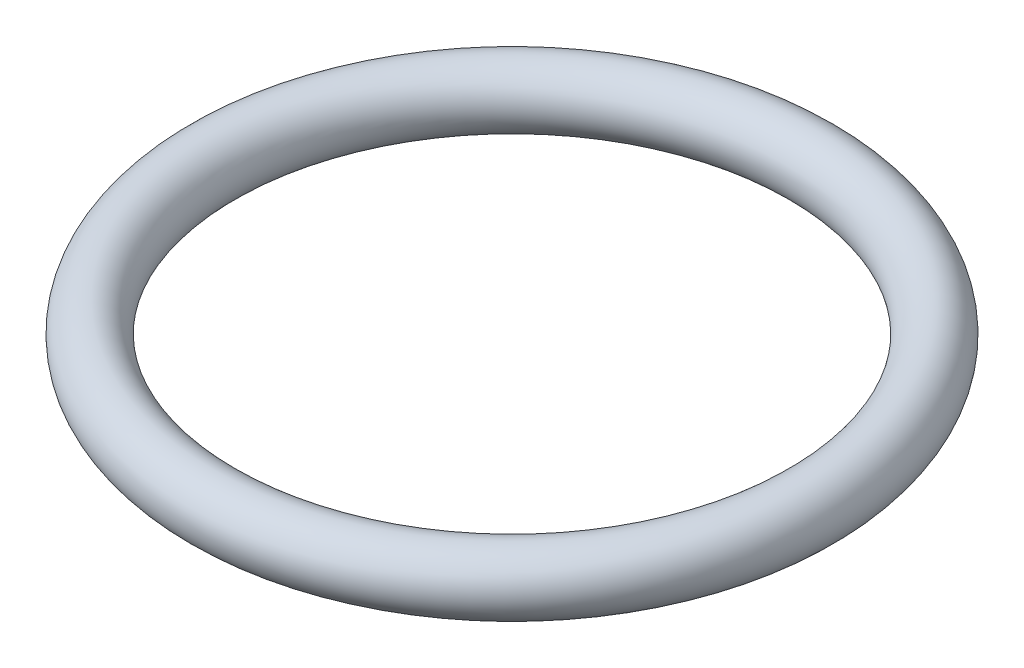
from build123d import *

# Parameters (mm, degrees)
SKETCH2_R = 0.89


with BuildPart() as part:
    # Sketch2 → Revolve3 (revolve)
    with BuildSketch(Plane.XY, mode=Mode.PRIVATE) as revolve3_sk:
        Circle(SKETCH2_R)
    revolve(revolve3_sk.sketch.rotate(Axis((8.61, 0, 0), (0, 1, 0)), 270), axis=Axis((8.61, 0, 0), (0, 1, 0)))


solid = part.part
